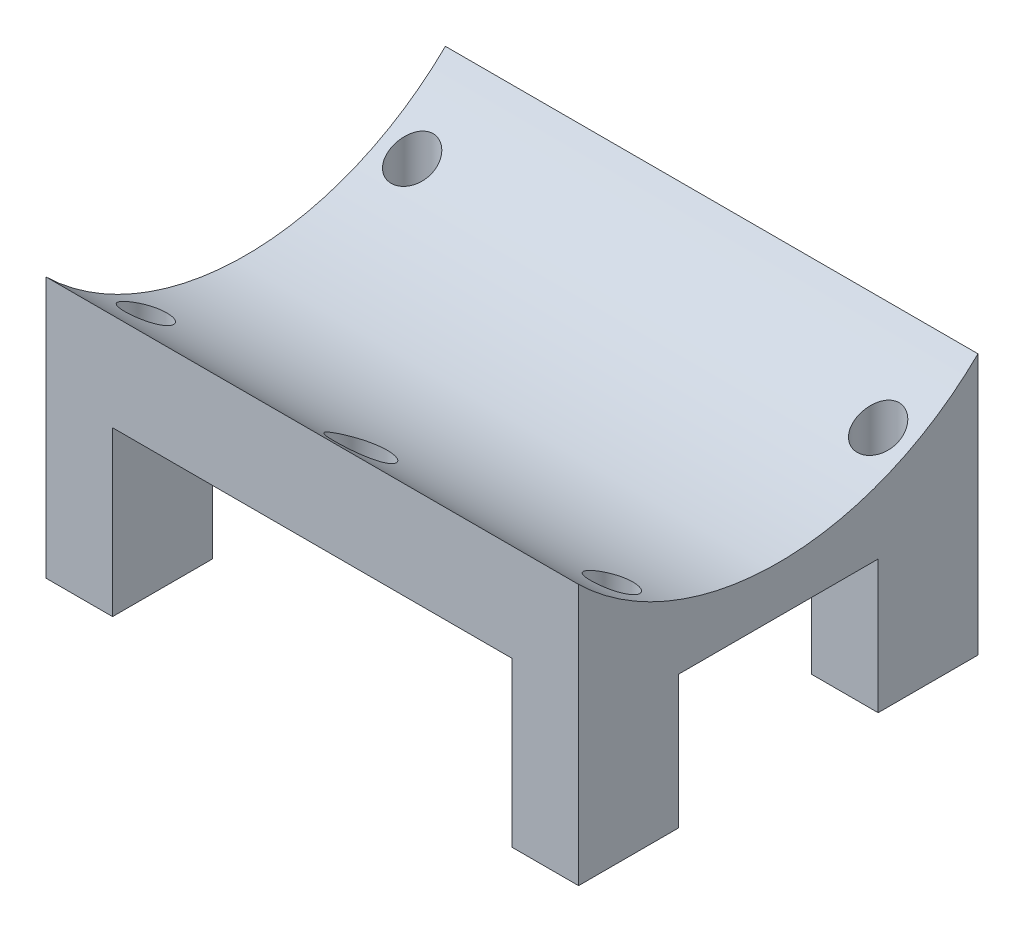
from build123d import *

# Parameters (mm, degrees)
BOSS_EXTRUDE1_DEPTH     = 101.6
SKETCH2_R               = 2
CUT_EXTRUDE1_DEPTH      = 120.381228758
SKETCH3_W               = 76.2
SKETCH3_H               = 62.425931944
CUT_EXTRUDE2_DEPTH      = 133.301446423
BOSS_EXTRUDE2_START     = -76.2
BOSS_EXTRUDE2_DEPTH     = 76.2
CUT_EXTRUDE3_DEPTH      = 27.94
CUT_EXTRUDE3_DEPTH_BACK = 19.05
SKETCH5_R               = 4
SKETCH6_W               = 38.1
SKETCH6_H               = 50.8
CUT_EXTRUDE4_DEPTH      = 115.668403311
SKETCH9_R               = 5
CUT_EXTRUDE6_DEPTH      = 15.24
SKETCH10_R              = 2.5
CUT_EXTRUDE7_DEPTH      = 113.708475404


with BuildPart() as part:
    # Sketch1 → Boss-Extrude1 (new body)
    with BuildSketch(Plane(origin=(0, 0, 0), x_dir=(0, 0, -1), z_dir=(1, 0, 0))):
        with BuildLine():
            Line((-38.1, 37.076578626), (-38.1, -12.7))
            Line((-38.1, -12.7), (38.1, -12.7))
            Line((38.1, -12.7), (38.1, 37.076578626))
            ThreePointArc((38.1, 37.076578626), (0, 21.59), (-38.1, 37.076578626))
        make_face()
    extrude(amount=BOSS_EXTRUDE1_DEPTH)

    # Sketch2 → Cut-Extrude1 (cut, through all)
    with BuildSketch(Plane(origin=(0, -12.7, 0), x_dir=(-1, 0, 0), z_dir=(0, -1, 0))):
        with Locations(Location((-6.35, -25.4, 0), (0, 0, 90))):
            Circle(SKETCH2_R)
        with Locations(Location((-6.35, 25.4, 0), (0, 0, 90))):
            Circle(SKETCH2_R)
        with Locations(Location((-95.25, -25.4, 0), (0, 0, 90))):
            Circle(SKETCH2_R)
        with Locations(Location((-95.25, 25.4, 0), (0, 0, 90))):
            Circle(SKETCH2_R)
    extrude(amount=-CUT_EXTRUDE1_DEPTH, mode=Mode.SUBTRACT)

    # Sketch3 → Cut-Extrude2 (cut, through all)
    with BuildSketch(Plane(origin=(0, 0, -38.1), x_dir=(-1, 0, 0), z_dir=(0, 0, -1))):
        with Locations((-50.8, -12.7)):
            Rectangle(SKETCH3_W, SKETCH3_H)
    extrude(amount=-CUT_EXTRUDE2_DEPTH, mode=Mode.SUBTRACT)

    # Sketch4 → Boss-Extrude2 (add)
    with BuildSketch(Plane(origin=(101.6, 0, 0), x_dir=(0, 0, -1), z_dir=(1, 0, 0)).offset(BOSS_EXTRUDE2_START)):
        with BuildLine():
            Line((-38.1, 37.076578626), (-38.1, 33.602905029))
            ThreePointArc((-38.1, 33.602905029), (0, 19.05), (38.1, 33.602905029))
            Line((38.1, 33.602905029), (38.1, 37.076578626))
            ThreePointArc((38.1, 37.076578626), (0, 21.59), (-38.1, 37.076578626))
        make_face()
    extrude(amount=BOSS_EXTRUDE2_DEPTH)

    # Sketch5 → Cut-Extrude3 (cut, two sides: drawn at the far end of the back side and taken through both)
    with BuildSketch(Plane(origin=(0, 17.78, 0), x_dir=(-1, 0, 0), z_dir=(0, -1, 0)).offset(-CUT_EXTRUDE3_DEPTH_BACK)):
        with Locations(Location((-95.25, 25.4, 0), (0, 0, 90))):
            Circle(SKETCH5_R)
        with Locations(Location((-6.35, 25.4, 0), (0, 0, 90))):
            Circle(SKETCH5_R)
        with Locations(Location((-6.35, -25.4, 0), (0, 0, 90))):
            Circle(SKETCH5_R)
        with Locations(Location((-95.25, -25.4, 0), (0, 0, 90))):
            Circle(SKETCH5_R)
    extrude(amount=CUT_EXTRUDE3_DEPTH + CUT_EXTRUDE3_DEPTH_BACK, mode=Mode.SUBTRACT)

    # Sketch6 → Cut-Extrude4 (cut, through all)
    with BuildSketch(Plane(origin=(101.6, 0, 0), x_dir=(0, 0, -1), z_dir=(1, 0, 0))):
        with Locations((0, -12.7)):
            Rectangle(SKETCH6_W, SKETCH6_H)
    extrude(amount=-CUT_EXTRUDE4_DEPTH, mode=Mode.SUBTRACT)

    # Sketch9 → Cut-Extrude6 (cut)
    with BuildSketch(Plane(origin=(0, 38.1, 0), x_dir=(-1, 0, 0), z_dir=(0, -1, 0))):
        with Locations(Location((-51.475148777, -29.522267927, 0), (0, 0, 270))):
            Circle(SKETCH9_R)
    extrude(amount=CUT_EXTRUDE6_DEPTH, mode=Mode.SUBTRACT)

    # Sketch10 → Cut-Extrude7 (cut, through all)
    with BuildSketch(Plane(origin=(0, 17.78, 0), x_dir=(-1, 0, 0), z_dir=(0, -1, 0))):
        with Locations(Location((-51.475148777, -29.522267927, 0), (0, 0, 90))):
            Circle(SKETCH10_R)
    extrude(amount=-CUT_EXTRUDE7_DEPTH, mode=Mode.SUBTRACT)


solid = part.part
